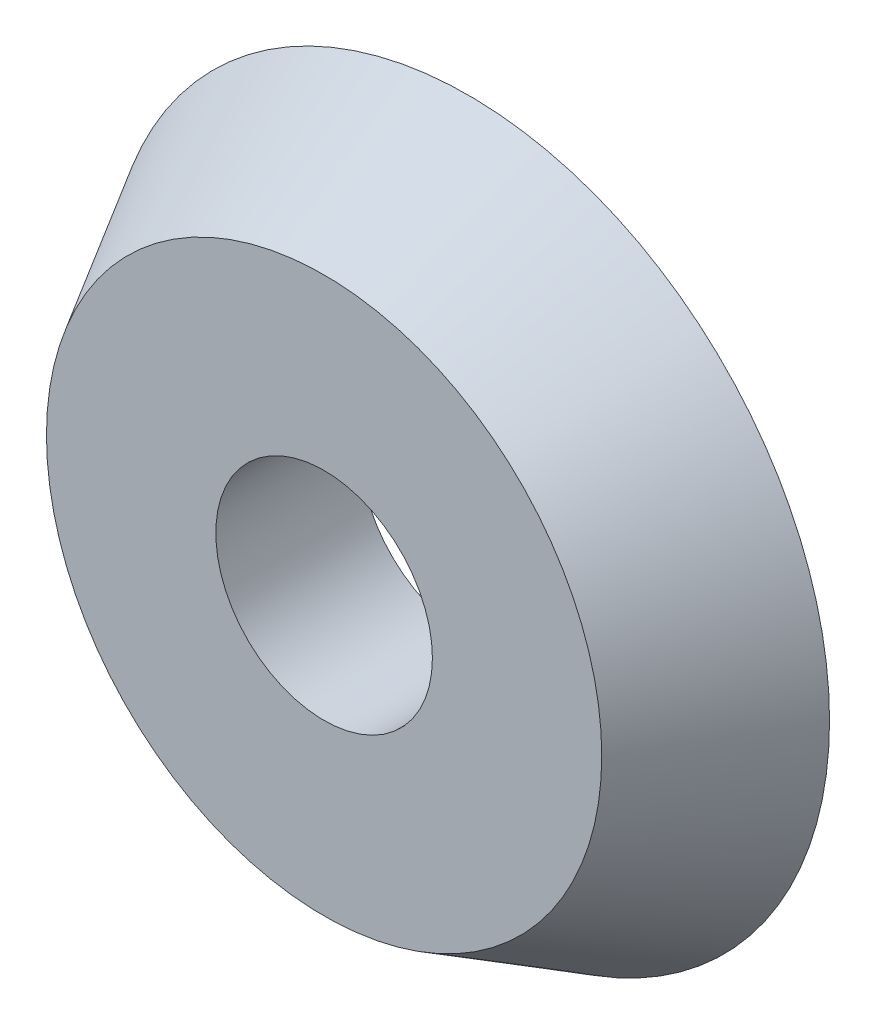
from build123d import *

# Parameters (mm, degrees)
SKETCH1_R           = 50
BOSS_EXTRUDE1_DEPTH = 20
BOSS_EXTRUDE1_TAPER = 30
SKETCH3_R           = 15
CUT_EXTRUDE2_DEPTH  = 74.484692283


with BuildPart() as part:
    # Sketch1 → Boss-Extrude1 (new body)
    with BuildSketch(Plane(origin=(0, 0, 0), x_dir=(0, 1, 0), z_dir=(0, 0, 1))):
        Circle(SKETCH1_R)
    extrude(amount=BOSS_EXTRUDE1_DEPTH, taper=BOSS_EXTRUDE1_TAPER)

    # Sketch3 → Cut-Extrude2 (cut, through all)
    with BuildSketch(Plane.XY.offset(20)):
        Circle(SKETCH3_R)
    extrude(amount=-CUT_EXTRUDE2_DEPTH, mode=Mode.SUBTRACT)


solid = part.part
